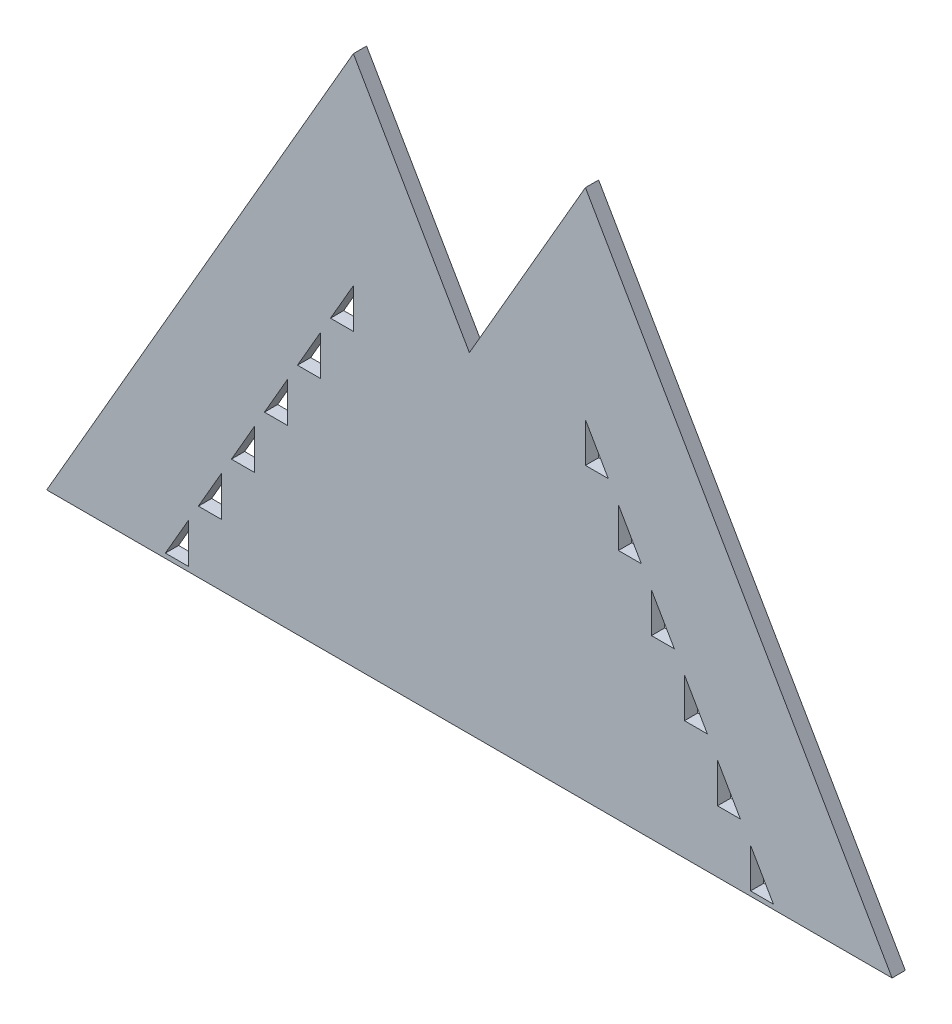
from build123d import *

# Parameters (mm, degrees)
EXTRUDE_1_DEPTH     = 1
CUT_EXTRUDE_1_DEPTH = 52.40107317


with BuildPart() as part:
    # 草图1 → 凸台-拉伸1 (new body)
    with BuildSketch(Plane.XY):
        Polygon((-32, 0), (32, 0), (8.783121635, 40.212812921), (0, 25), (-8.783121635, 40.212812921), align=None)
    extrude(amount=EXTRUDE_1_DEPTH)

    # 草图2 → 切除-拉伸1 (cut, through all)
    with BuildSketch(Plane.XY.offset(1)):
        Polygon((-8.783121635, 25), (-10.515172443, 22), (-8.783121635, 22), align=None)
        Polygon((-11.283121635, 17.669872981), (-11.283121635, 20.669872981), (-13.015172443, 17.669872981), align=None)
        Polygon((-13.783121635, 13.339745962), (-13.783121635, 16.339745962), (-15.515172443, 13.339745962), align=None)
        Polygon((-16.283121635, 9.009618943), (-16.283121635, 12.009618943), (-18.015172443, 9.009618943), align=None)
        Polygon((-18.783121635, 4.679491924), (-18.783121635, 7.679491924), (-20.515172443, 4.679491924), align=None)
        Polygon((-21.283121635, 0.349364905), (-21.283121635, 3.349364905), (-23.015172443, 0.349364905), align=None)
        Polygon((23.015172443, 0.349364905), (21.283121635, 0.349364905), (21.283121635, 3.349364905), align=None)
        Polygon((20.515172443, 4.679491924), (18.783121635, 4.679491924), (18.783121635, 7.679491924), align=None)
        Polygon((18.015172443, 9.009618943), (16.283121635, 9.009618943), (16.283121635, 12.009618943), align=None)
        Polygon((15.515172443, 13.339745962), (13.783121635, 13.339745962), (13.783121635, 16.339745962), align=None)
        Polygon((13.015172443, 17.669872981), (11.283121635, 17.669872981), (11.283121635, 20.669872981), align=None)
        Polygon((10.515172443, 22), (8.783121635, 22), (8.783121635, 25), align=None)
    extrude(amount=-CUT_EXTRUDE_1_DEPTH, mode=Mode.SUBTRACT)


solid = part.part
